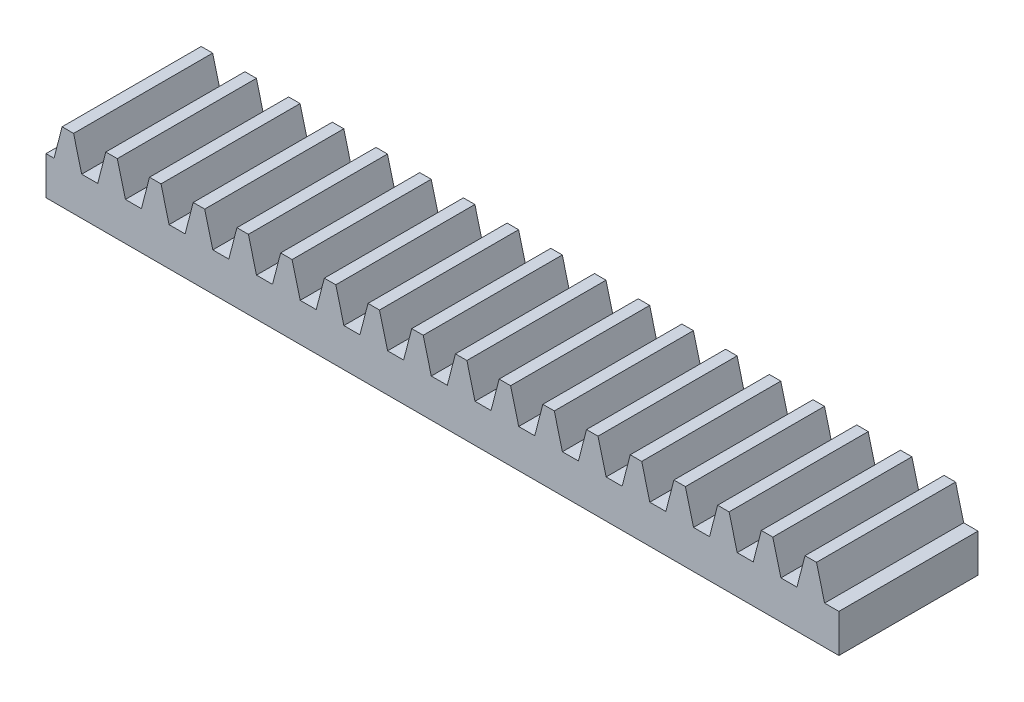
from build123d import *

# Parameters (mm, degrees)
BLANKSKE_W        = 57
BLANKSKE_H        = 5
BLANK_DEPTH       = 10
TOOTHCUTSIM_DEPTH = 59.086142926
TEETHCUTS_COUNT   = 19
TEETHCUTS_PITCH   = 3.14159265


with BuildPart() as part:
    # BlankSke → Blank (new body)
    with BuildSketch(Plane.XY):
        with Locations((28.5, 2.5)):
            Rectangle(BLANKSKE_W, BLANKSKE_H)
    extrude(amount=-BLANK_DEPTH)

    # TooCutSkeSim → ToothCutSim (cut, through all)
    with BuildSketch(Plane.XY):
        Polygon((0.576126182, 2.75), (-0.576126182, 2.75), (-1.164584633, 5.0254), (1.164584633, 5.0254), align=None)
    toothcutsim = extrude(amount=-TOOTHCUTSIM_DEPTH, mode=Mode.SUBTRACT)

    # TeethCuts: ToothCutSim ×19
    with Locations(*[(i * TEETHCUTS_PITCH, 0, 0) for i in range(1, TEETHCUTS_COUNT)]):
        add(toothcutsim, mode=Mode.SUBTRACT)


solid = part.part
